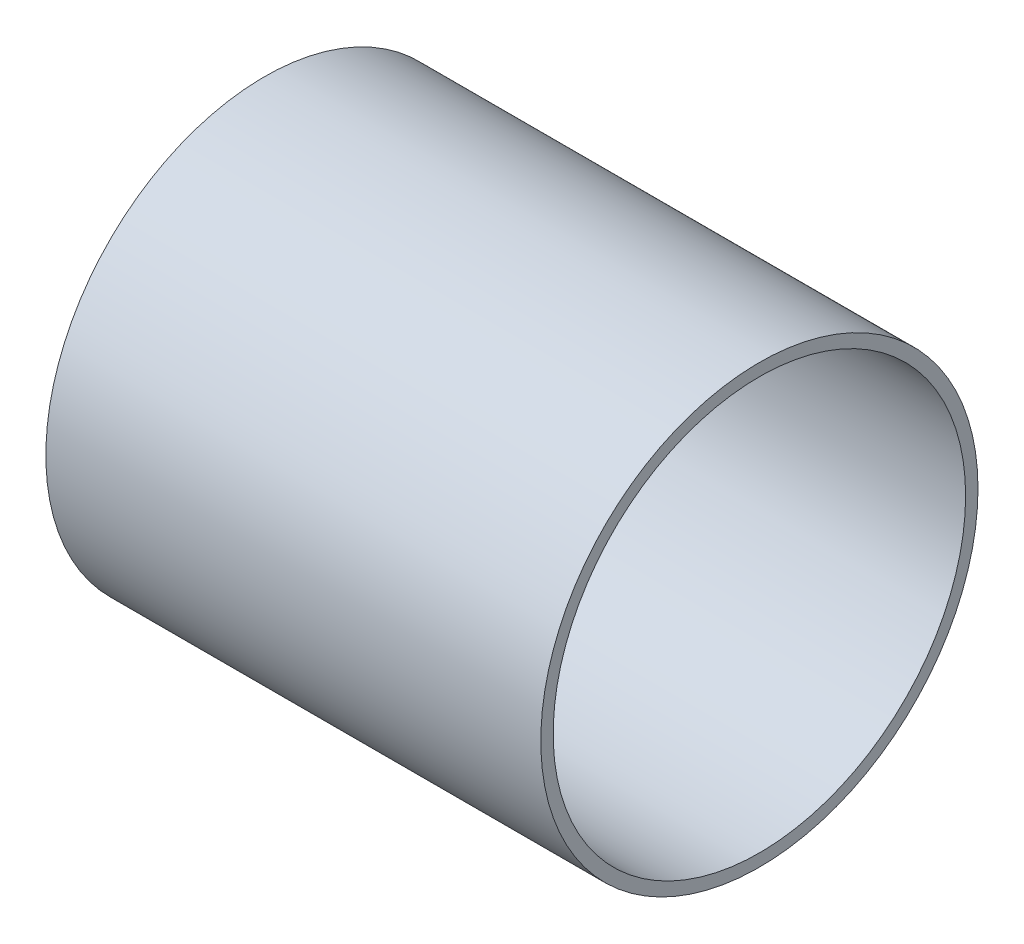
from build123d import *

# Parameters (mm, degrees)
SKETCH_1_W = 180
SKETCH_1_H = 4.5


with BuildPart() as part:
    # Эскиз1 → Повернуть1 (revolve)
    with BuildSketch(Plane.XY, mode=Mode.PRIVATE) as revolve_1_sk:
        with Locations((90, 77.25)):
            Rectangle(SKETCH_1_W, SKETCH_1_H)
    revolve(revolve_1_sk.sketch.rotate(Axis((0, 0, 0), (-1, 0, 0)), 90), axis=Axis((0, 0, 0), (-1, 0, 0)))


solid = part.part
